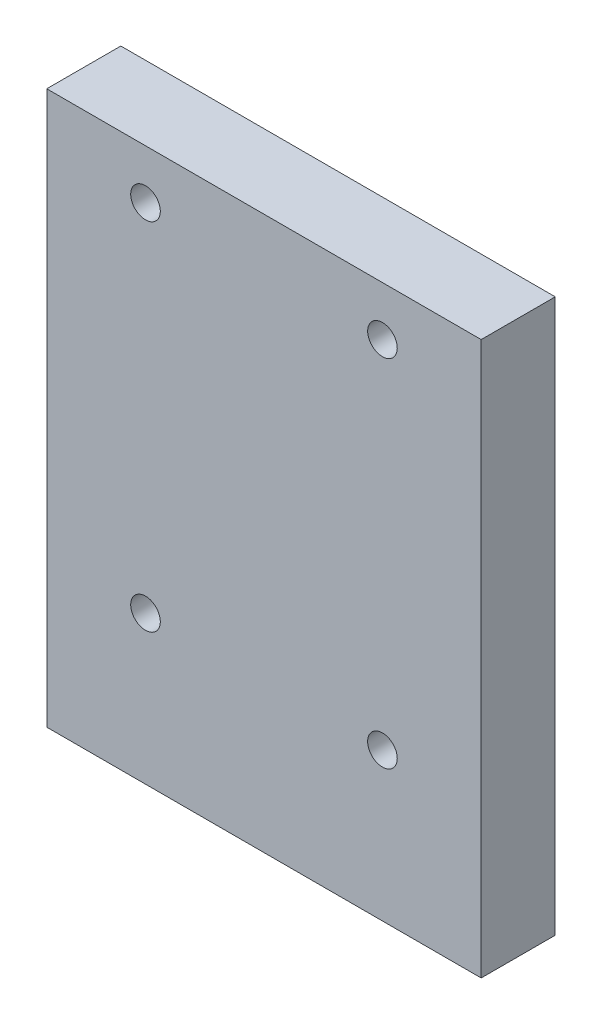
from build123d import *

# Parameters (mm, degrees)
SKETCH_1_W          = 44
SKETCH_1_H          = 56
SKETCH_1_R          = 1.5
EXTRUDE_1_DEPTH     = 7.5
SKETCH_2_R          = 1.5
CUT_EXTRUDE_1_DEPTH = 3


with BuildPart() as part:
    # 草圖1 → 填料-伸長1 (new body)
    with BuildSketch(Plane.XY):
        with Locations((0, -5)):
            Rectangle(SKETCH_1_W, SKETCH_1_H)
        with Locations((-12, 18)):
            Circle(SKETCH_1_R, mode=Mode.SUBTRACT)
        with Locations((12, 18)):
            Circle(SKETCH_1_R, mode=Mode.SUBTRACT)
        with Locations((12, -18)):
            Circle(SKETCH_1_R, mode=Mode.SUBTRACT)
        with Locations((-12, -18)):
            Circle(SKETCH_1_R, mode=Mode.SUBTRACT)
    extrude(amount=EXTRUDE_1_DEPTH)

    # 草圖2 → 除料-伸長1 (cut)
    with BuildSketch(Plane(origin=(0, -33, 0), x_dir=(-1, 0, 0), z_dir=(0, -1, 0))):
        with Locations(Location((-6, -3.75, 0), (0, 0, 90))):
            Circle(SKETCH_2_R)
        with Locations(Location((-18, -3.75, 0), (0, 0, 90))):
            Circle(SKETCH_2_R)
        with Locations(Location((6, -3.75, 0), (0, 0, 90))):
            Circle(SKETCH_2_R)
        with Locations(Location((18, -3.75, 0), (0, 0, 90))):
            Circle(SKETCH_2_R)
    extrude(amount=-CUT_EXTRUDE_1_DEPTH, mode=Mode.SUBTRACT)


solid = part.part
